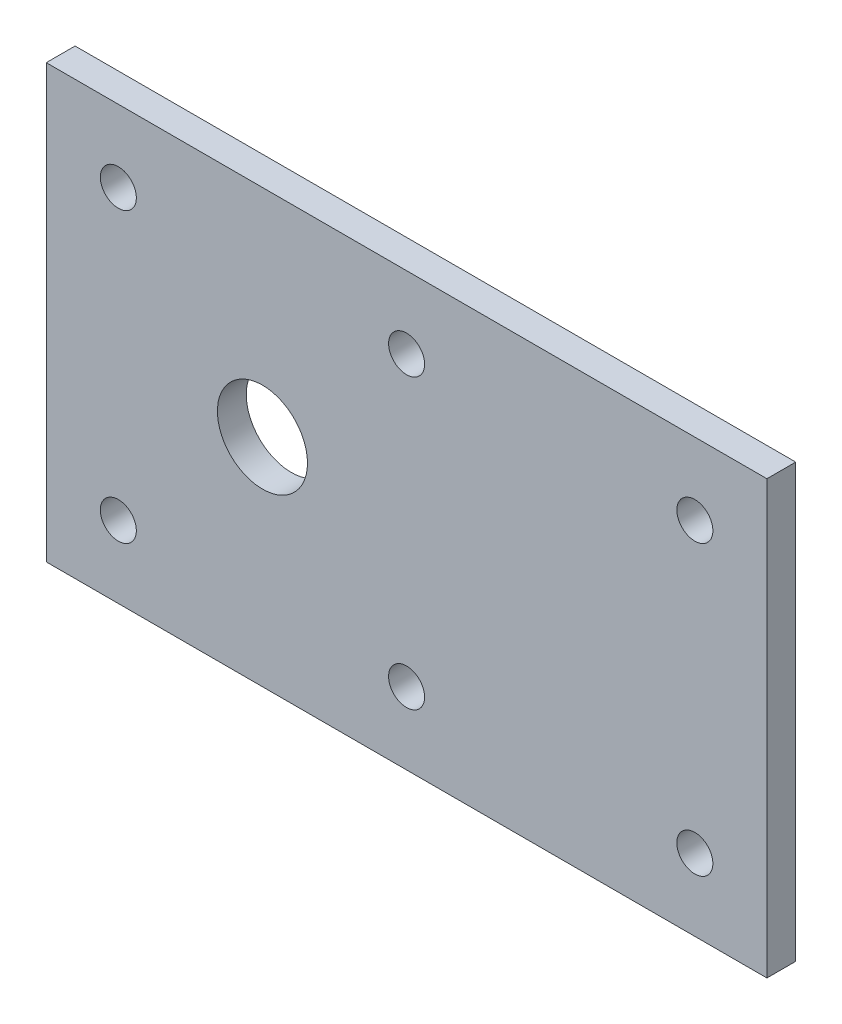
from build123d import *

# Parameters (mm, degrees)
SKETCH1_W            = 200
SKETCH1_H            = 120
BOSS_EXTRUDE2_DEPTH  = 8
SKETCH2_R            = 5
CUT_EXTRUDE1_DEPTH   = 153.52540772
LPATTERN1_COUNT      = 3
LPATTERN1_PITCH      = 80
LPATTERN1_COUNT_DIR2 = 2
LPATTERN1_PITCH_DIR2 = 80
SKETCH5_R            = 12.5
CUT_EXTRUDE2_DEPTH   = 153.52540772


with BuildPart() as part:
    # Sketch1 → Boss-Extrude2 (new body)
    with BuildSketch(Plane.XY):
        with Locations((40, 0)):
            Rectangle(SKETCH1_W, SKETCH1_H)
    extrude(amount=BOSS_EXTRUDE2_DEPTH)

    # Sketch2 → Cut-Extrude1 (cut, through all)
    with BuildSketch(Plane.XY.offset(8)):
        with Locations((-40, 40)):
            Circle(SKETCH2_R)
    cut_extrude1 = extrude(amount=-CUT_EXTRUDE1_DEPTH, mode=Mode.SUBTRACT)

    # LPattern1: Cut-Extrude1 3 × 2
    with Locations(*[(i * LPATTERN1_PITCH, -j * LPATTERN1_PITCH_DIR2, 0) for i in range(LPATTERN1_COUNT) for j in range(LPATTERN1_COUNT_DIR2) if (i, j) != (0, 0)]):
        add(cut_extrude1, mode=Mode.SUBTRACT)

    # Sketch5 → Cut-Extrude2 (cut, through all)
    with BuildSketch(Plane.XY.offset(8)):
        Circle(SKETCH5_R)
    extrude(amount=-CUT_EXTRUDE2_DEPTH, mode=Mode.SUBTRACT)


solid = part.part
